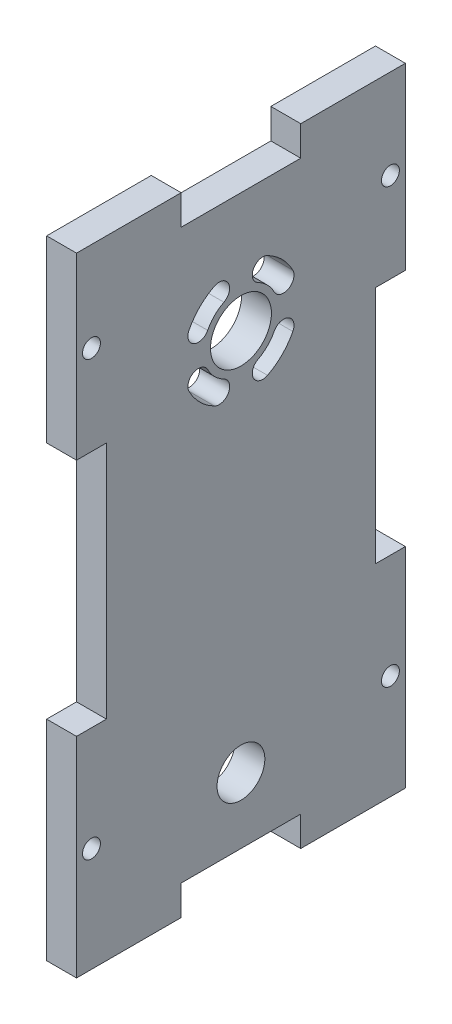
from build123d import *

# Parameters (mm, degrees)
SKETCH_1_R      = 4
SKETCH_1_R_2    = 5.1
SKETCH_1_R_3    = 1.5
EXTRUDE_1_DEPTH = 5


with BuildPart() as part:
    # 草图1 → 凸台-拉伸1 (new body)
    with BuildSketch(Plane(origin=(0, 0, 0), x_dir=(0, 0, -1), z_dir=(1, 0, 0))):
        Polygon((-37.5, 105), (-55, 105), (-55, 75), (-50, 75), (-50, 35), (-55, 35), (-55, 0), (-37.5, 0), (-37.5, 5), (-17.5, 5), (-17.5, 0), (0, 0), (0, 35), (-5, 35), (-5, 75), (0, 75), (0, 105), (-17.5, 105), (-17.5, 100), (-37.5, 100), align=None)
        with Locations((-27.5, 16)):
            Circle(SKETCH_1_R, mode=Mode.SUBTRACT)
        with Locations((-27.5, 80)):
            Circle(SKETCH_1_R_2, mode=Mode.SUBTRACT)
        with Locations((-2.5, 90)):
            Circle(SKETCH_1_R_3, mode=Mode.SUBTRACT)
        with Locations((-52.5, 90)):
            Circle(SKETCH_1_R_3, mode=Mode.SUBTRACT)
        with Locations((-52.5, 17.5)):
            Circle(SKETCH_1_R_3, mode=Mode.SUBTRACT)
        with Locations((-2.5, 17.5)):
            Circle(SKETCH_1_R_3, mode=Mode.SUBTRACT)
        with BuildLine():
            ThreePointArc((-31.944781032, 88.677927263), (-34.397440233, 86.891140561), (-36.181985067, 84.436849703))
            ThreePointArc((-36.181985067, 84.436849703), (-35.420037694, 82.082187052), (-33.065375043, 82.844134425))
            ThreePointArc((-33.065375043, 82.844134425), (-31.921436047, 84.417397795), (-30.34921861, 85.562773886))
            ThreePointArc((-30.34921861, 85.562773886), (-29.589423133, 87.918131785), (-31.944781032, 88.677927263))
        make_face(mode=Mode.SUBTRACT)
        with BuildLine():
            ThreePointArc((-18.822072737, 84.444781032), (-20.608859439, 86.897440233), (-23.063150297, 88.681985067))
            ThreePointArc((-23.063150297, 88.681985067), (-25.417812948, 87.920037694), (-24.655865575, 85.565375043))
            ThreePointArc((-24.655865575, 85.565375043), (-23.082602205, 84.421436047), (-21.937226114, 82.84921861))
            ThreePointArc((-21.937226114, 82.84921861), (-19.581868215, 82.089423133), (-18.822072737, 84.444781032))
        make_face(mode=Mode.SUBTRACT)
        with BuildLine():
            ThreePointArc((-23.055218968, 71.322072737), (-20.602559767, 73.108859439), (-18.818014933, 75.563150297))
            ThreePointArc((-18.818014933, 75.563150297), (-19.579962306, 77.917812948), (-21.934624957, 77.155865575))
            ThreePointArc((-21.934624957, 77.155865575), (-23.078563953, 75.582602205), (-24.65078139, 74.437226114))
            ThreePointArc((-24.65078139, 74.437226114), (-25.410576867, 72.081868215), (-23.055218968, 71.322072737))
        make_face(mode=Mode.SUBTRACT)
        with BuildLine():
            ThreePointArc((-36.177927263, 75.555218968), (-34.391140561, 73.102559767), (-31.936849703, 71.318014933))
            ThreePointArc((-31.936849703, 71.318014933), (-29.582187052, 72.079962306), (-30.344134425, 74.434624957))
            ThreePointArc((-30.344134425, 74.434624957), (-31.917397795, 75.578563953), (-33.062773886, 77.15078139))
            ThreePointArc((-33.062773886, 77.15078139), (-35.418131785, 77.910576867), (-36.177927263, 75.555218968))
        make_face(mode=Mode.SUBTRACT)
    extrude(amount=EXTRUDE_1_DEPTH)


solid = part.part
